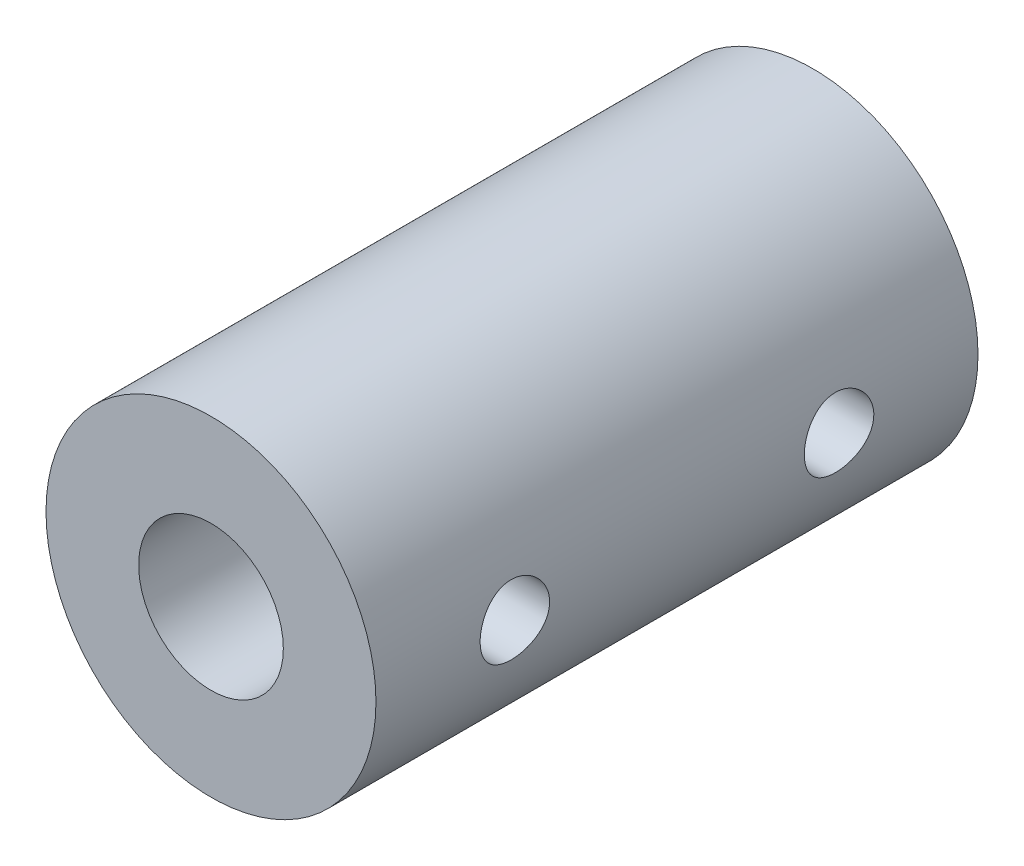
from build123d import *

# Parameters (mm, degrees)
BOSS_EXTRUDE1_DEPTH      = 13
BOSS_EXTRUDE1_DEPTH_BACK = 13
SKETCH1_R                = 7.125
SKETCH1_R_2              = 3.125
SKETCH2_R                = 1.5
CUT_EXTRUDE1_DEPTH       = 20


with BuildPart() as part:
    # Sketch1 → Boss-Extrude1 (new, two sides: drawn at the far end of the back side and taken through both)
    with BuildSketch(Plane.XY.offset(-BOSS_EXTRUDE1_DEPTH_BACK)):
        with Locations((-9.418504592, 11.87550579)):
            Circle(SKETCH1_R)
        with Locations((-9.418504592, 11.87550579)):
            Circle(SKETCH1_R_2, mode=Mode.SUBTRACT)
    extrude(amount=BOSS_EXTRUDE1_DEPTH + BOSS_EXTRUDE1_DEPTH_BACK)

    # Sketch2 → Cut-Extrude1 (cut)
    with BuildSketch(Plane(origin=(0, 0, 0), x_dir=(0, 0, -1), z_dir=(1, 0, 0))):
        with Locations((-7, 11.87550579)):
            Circle(SKETCH2_R)
    cut_extrude1 = extrude(amount=-CUT_EXTRUDE1_DEPTH, mode=Mode.SUBTRACT)

    # Mirror1: Cut-Extrude1 across plane
    add(cut_extrude1.mirror(Plane.XY), mode=Mode.SUBTRACT)


solid = part.part
